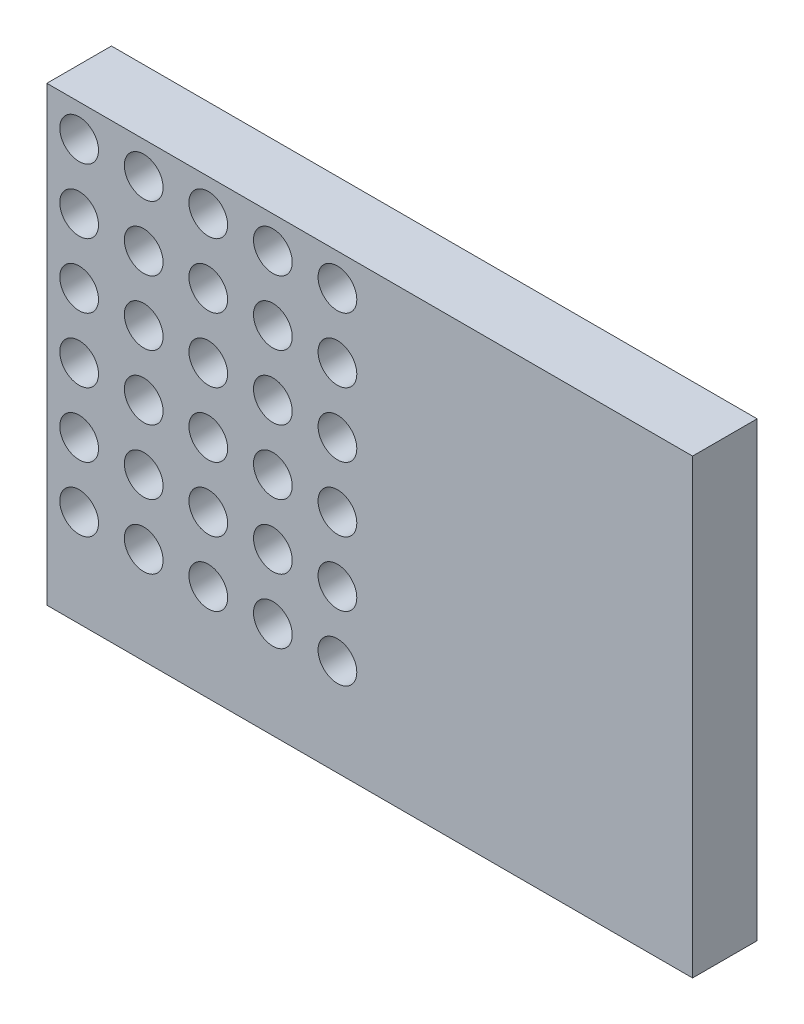
from build123d import *

# Parameters (mm, degrees)
SKETCH_1_W                  = 100
SKETCH_1_H                  = 70
EXTRUDE_1_DEPTH             = 5
SKETCH_2_R                  = 3
CUT_EXTRUDE_1_DEPTH         = 10
PATTERN_LINEAR_1_COUNT      = 5
PATTERN_LINEAR_1_PITCH      = 10
PATTERN_LINEAR_1_COUNT_DIR2 = 6
PATTERN_LINEAR_1_PITCH_DIR2 = 10


with BuildPart() as part:
    # 草图1 → 凸台-拉伸1 (new, symmetric)
    with BuildSketch(Plane.XY):
        Rectangle(SKETCH_1_W, SKETCH_1_H)
    extrude(amount=EXTRUDE_1_DEPTH, both=True)

    # 草图2 → 切除-拉伸1 (cut)
    with BuildSketch(Plane.XY.offset(5)):
        with Locations((-45, 30)):
            Circle(SKETCH_2_R)
    cut_extrude_1 = extrude(amount=-CUT_EXTRUDE_1_DEPTH, mode=Mode.SUBTRACT)

    # 阵列(线性)1: Cut-Extrude 1 5 × 6
    with Locations(*[(i * PATTERN_LINEAR_1_PITCH, -j * PATTERN_LINEAR_1_PITCH_DIR2, 0) for i in range(PATTERN_LINEAR_1_COUNT) for j in range(PATTERN_LINEAR_1_COUNT_DIR2) if (i, j) != (0, 0)]):
        add(cut_extrude_1, mode=Mode.SUBTRACT)


solid = part.part
